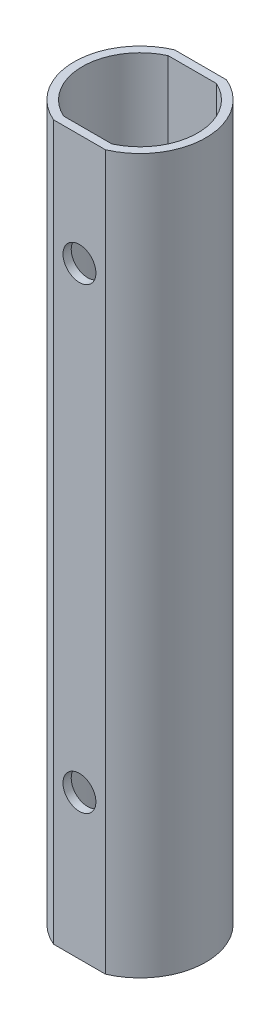
from build123d import *

# Parameters (mm, degrees)
BOSS_EXTRUDE1_DEPTH = 137.66
CUT_EXTRUDE1_REACH  = 142.202
SKETCH2_R           = 3.175


with BuildPart() as part:
    # Sketch1 → Boss-Extrude1 (new body)
    with BuildSketch(Plane(origin=(0, 0, 0), x_dir=(1, 0, 0), z_dir=(0, 1, 0))):
        with BuildLine():
            Line((-5, -11.674330816), (5, -11.674330816))
            ThreePointArc((5, -11.674330816), (12.7, 0), (5, 11.674330816))
            Line((5, 11.674330816), (-5, 11.674330816))
            ThreePointArc((-5, 11.674330816), (-12.7, 0), (-5, -11.674330816))
        make_face()
        with BuildLine():
            Line((-4.662992638, -10.086830816), (4.662992638, -10.086830816))
            ThreePointArc((4.662992638, -10.086830816), (11.1125, 0), (4.662992638, 10.086830816))
            Line((4.662992638, 10.086830816), (-4.662992638, 10.086830816))
            ThreePointArc((-4.662992638, 10.086830816), (-11.1125, 0), (-4.662992638, -10.086830816))
        make_face(mode=Mode.SUBTRACT)
    extrude(amount=BOSS_EXTRUDE1_DEPTH)

    # Cut-Extrude1: up to this face of the body (flat: up to its plane)
    cut_extrude1_end = Plane(part.part.faces().sort_by_distance((0, 68.83, 11.674330816))[0])
    # Sketch2 → Cut-Extrude1 (cut, up to the picked face)
    with BuildSketch(Plane(origin=(0, 0, -11.674330816), x_dir=(-1, 0, 0), z_dir=(0, 0, -1)), mode=Mode.PRIVATE) as cut_extrude1_sk1:
        with Locations((0, 27.85)):
            Circle(SKETCH2_R)
    cut_extrude1_tool1 = split(extrude(cut_extrude1_sk1.sketch, amount=-CUT_EXTRUDE1_REACH, mode=Mode.PRIVATE), bisect_by=cut_extrude1_end, keep=Keep.BOTH, mode=Mode.PRIVATE)
    # Sketch2 → Cut-Extrude1 (cut, up to the picked face)
    with BuildSketch(Plane(origin=(0, 0, -11.674330816), x_dir=(-1, 0, 0), z_dir=(0, 0, -1)), mode=Mode.PRIVATE) as cut_extrude1_sk2:
        with Locations((0, 116.16)):
            Circle(SKETCH2_R)
    cut_extrude1_tool2 = split(extrude(cut_extrude1_sk2.sketch, amount=-CUT_EXTRUDE1_REACH, mode=Mode.PRIVATE), bisect_by=cut_extrude1_end, keep=Keep.BOTH, mode=Mode.PRIVATE)
    add(cut_extrude1_tool1.solids().sort_by(Axis((0, 27.85, -11.674331), (0, 0, 1)))[0], mode=Mode.SUBTRACT)
    add(cut_extrude1_tool2.solids().sort_by(Axis((0, 116.16, -11.674331), (0, 0, 1)))[0], mode=Mode.SUBTRACT)


solid = part.part
